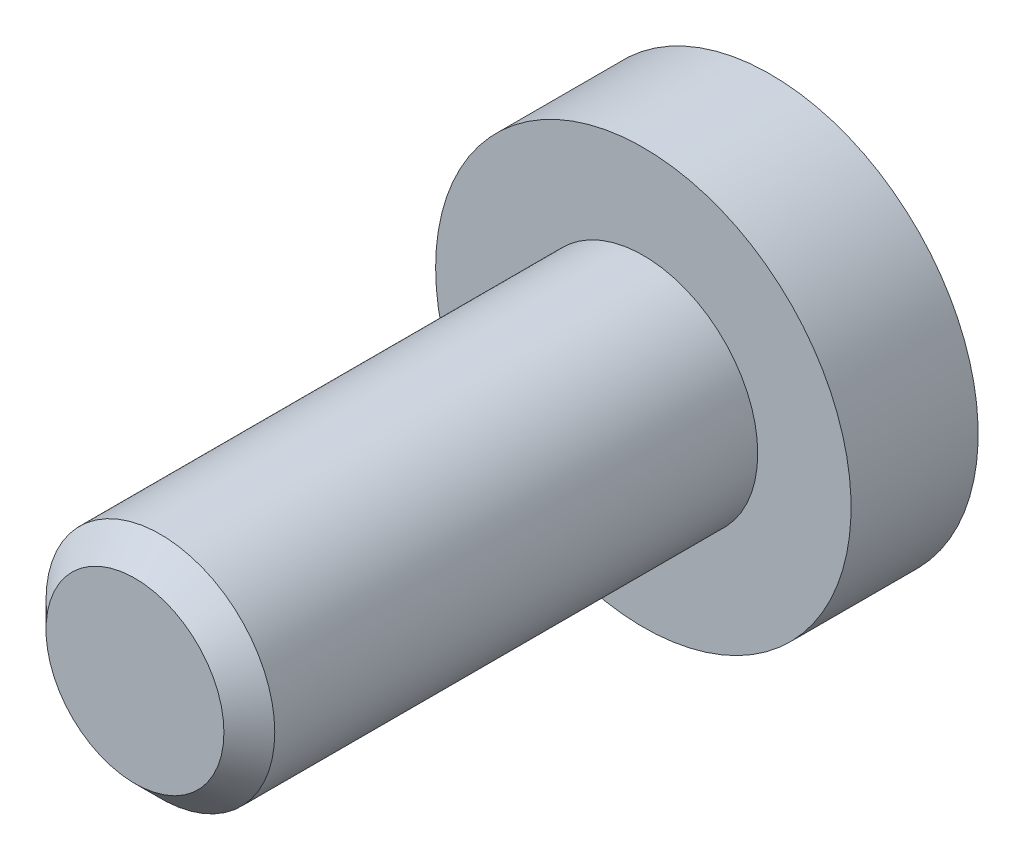
from build123d import *

# Parameters (mm, degrees)
SKETCH1_R           = 10
BOSS_EXTRUDE1_DEPTH = 50
SKETCH2_R           = 16.344073083
BOSS_EXTRUDE2_DEPTH = 10
CHAMFER1_SIZE       = 3
SKETCH3_OUTSIDE_W   = 48.308
SKETCH3_OUTSIDE_H   = 48.308
SKETCH3_OUTSIDE_R   = 9
CUT_EXTRUDE1_DEPTH  = 40


with BuildPart() as part:
    # Sketch1 → Boss-Extrude1 (new body)
    with BuildSketch(Plane.XY):
        Circle(SKETCH1_R)
    extrude(amount=BOSS_EXTRUDE1_DEPTH)

    # Sketch2 → Boss-Extrude2 (add)
    with BuildSketch(Plane(origin=(0, 0, 0), x_dir=(-1, 0, 0), z_dir=(0, 0, -1))):
        Circle(SKETCH2_R)
    extrude(amount=-BOSS_EXTRUDE2_DEPTH)

    # Chamfer1
    chamfer1_edges = [part.edges().sort_by_distance(p)[0] for p in [
        (-10, 0, 50),
    ]]
    chamfer(chamfer1_edges, length=CHAMFER1_SIZE)

    # Sketch3 outside → Cut-Extrude1 (cut)
    with BuildSketch(Plane.XY.offset(50)):
        Rectangle(SKETCH3_OUTSIDE_W, SKETCH3_OUTSIDE_H)
        Circle(SKETCH3_OUTSIDE_R, mode=Mode.SUBTRACT)
    extrude(amount=-CUT_EXTRUDE1_DEPTH, mode=Mode.SUBTRACT)


solid = part.part
